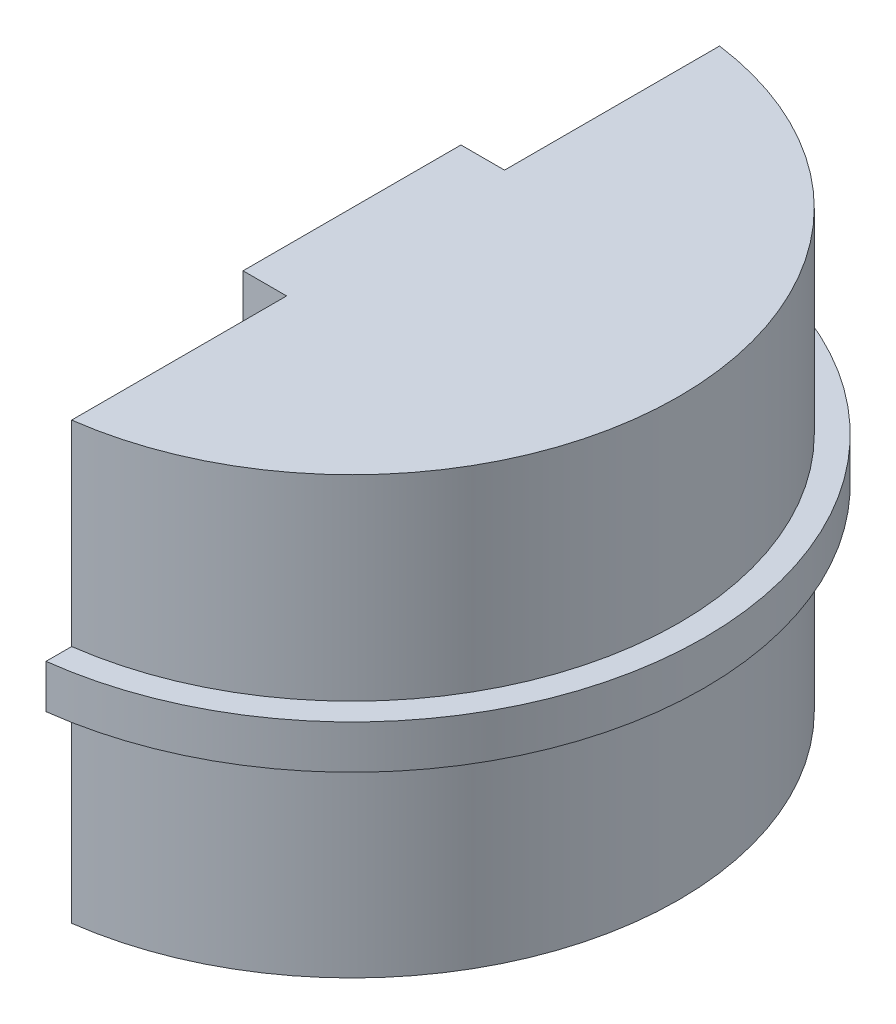
from build123d import *

# Parameters (mm, degrees)
BOSS_EXTRUDE1_DEPTH = 100
BOSS_EXTRUDE2_DEPTH = 5


with BuildPart() as part:
    # Sketch1 → Boss-Extrude1 (new body)
    with BuildSketch(Plane(origin=(0, 0, 0), x_dir=(1, 0, 0), z_dir=(0, 1, 0))):
        with BuildLine():
            Line((-113.861275844, 23.426394533), (-103.861275844, 23.426394533))
            Line((-103.861275844, 23.426394533), (-103.861275844, 72.756738269))
            ThreePointArc((-103.861275844, 72.756738269), (-38.861275844, -1.573605467), (-103.861275844, -75.903949204))
            Line((-103.861275844, -75.903949204), (-103.861275844, -26.573605467))
            Line((-103.861275844, -26.573605467), (-113.861275844, -26.573605467))
            Line((-113.861275844, -26.573605467), (-113.861275844, 23.426394533))
        make_face()
    extrude(amount=BOSS_EXTRUDE1_DEPTH)

    # Sketch2 → Boss-Extrude2 (add, symmetric)
    with BuildSketch(Plane(origin=(0, 50, 0), x_dir=(1, 0, 0), z_dir=(0, 1, 0))):
        with BuildLine():
            Line((-103.861275844, -75.903949204), (-103.861275844, -81.787530662))
            ThreePointArc((-103.861275844, -81.787530662), (-33.026420768, -1.573605467), (-103.861275844, 78.640319727))
            Line((-103.861275844, 78.640319727), (-103.861275844, 72.756738269))
            ThreePointArc((-103.861275844, 72.756738269), (-38.861275844, -1.573605467), (-103.861275844, -75.903949204))
        make_face()
    extrude(amount=BOSS_EXTRUDE2_DEPTH, both=True)


solid = part.part
